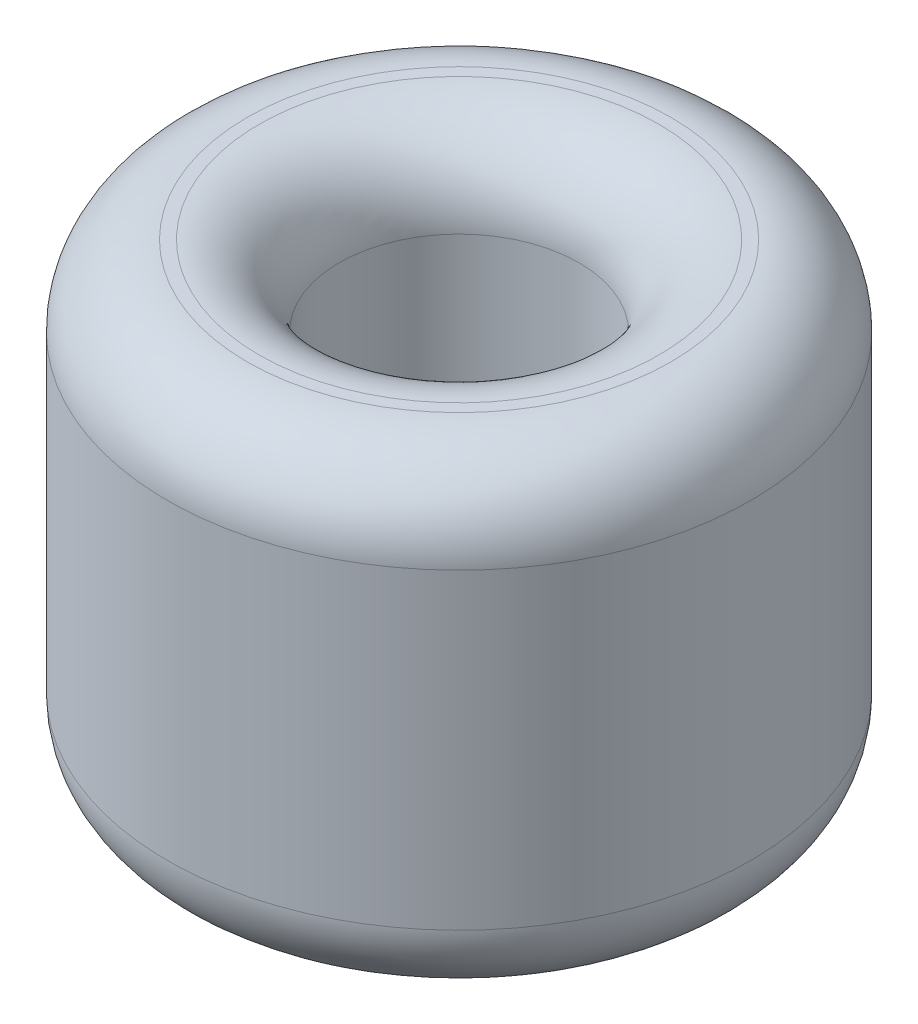
from build123d import *


with BuildPart() as part:
    # Sketch1 → Revolve1 (revolve)
    with BuildSketch(Plane.XY, mode=Mode.PRIVATE) as revolve1_sk:
        with BuildLine():
            Line((1.5, 4.9), (1.5, 1))
            ThreePointArc((1.5, 1), (1.792893219, 0.292893219), (2.5, 0))
            Line((2.5, 0), (2.65, 0))
            ThreePointArc((2.65, 0), (3.357106781, 0.292893219), (3.65, 1))
            Line((3.65, 1), (3.65, 4.9))
            ThreePointArc((3.65, 4.9), (3.357106781, 5.607106781), (2.65, 5.9))
            Line((2.65, 5.9), (2.5, 5.9))
            ThreePointArc((2.5, 5.9), (1.792893219, 5.607106781), (1.5, 4.9))
        make_face()
    revolve(revolve1_sk.sketch.rotate(Axis((0, 5.902912508, 0), (0, -1, 0)), 270), axis=Axis((0, 5.902912508, 0), (0, -1, 0)))


solid = part.part
